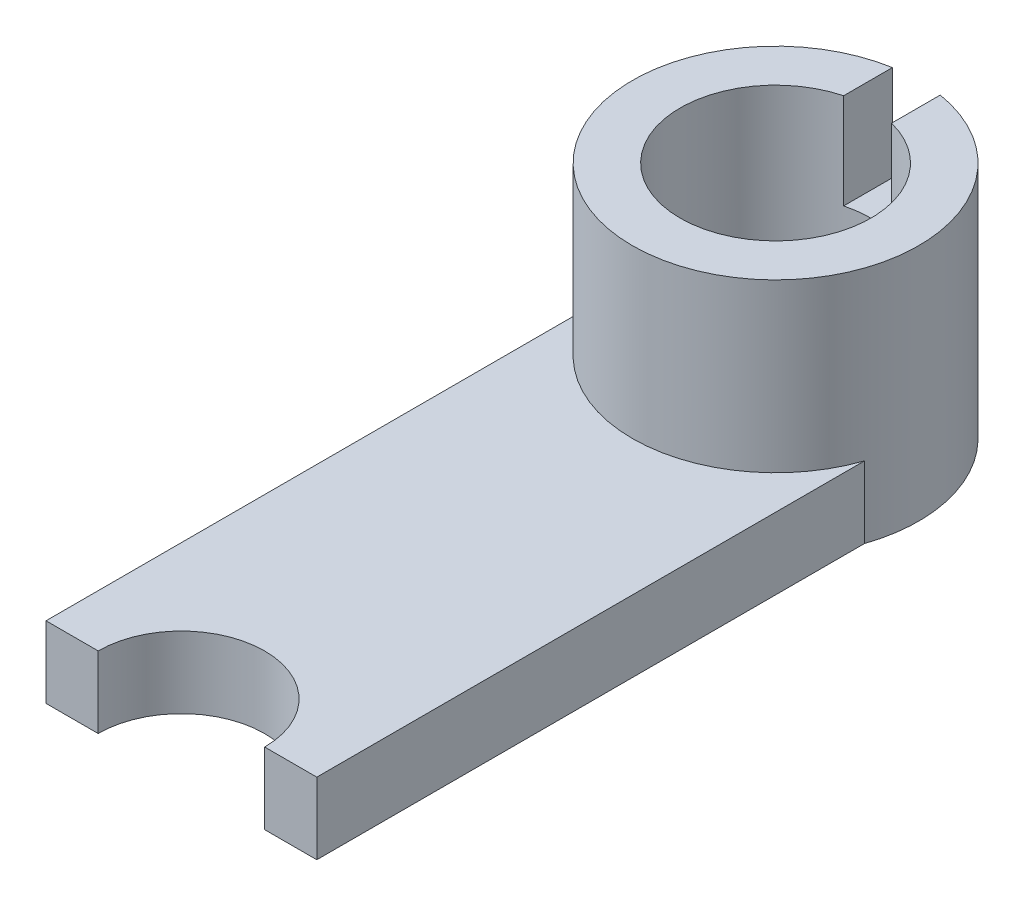
from build123d import *

# Parameters (mm, degrees)
SKETCH2_R               = 60000
SKETCH2_R_2             = 40000
BOSS_EXTRUDE1_DEPTH     = 100000
CUT_EXTRUDE1_DEPTH      = 14630
CUT_EXTRUDE1_DEPTH_BACK = 40000
SKETCH3_W               = 20000
SKETCH3_H               = 53751.270372234
SKETCH6_W               = 113487.639637956
SKETCH6_H               = 229519.025629528
BOSS_EXTRUDE3_DEPTH     = 30000
CUT_EXTRUDE2_DEPTH      = 28505
CUT_EXTRUDE2_DEPTH_BACK = 58994
SKETCH7_R               = 34880.887530656
CUT_EXTRUDE4_DEPTH      = 51190
CUT_EXTRUDE4_DEPTH_BACK = 76239
SKETCH8_R               = 40000


with BuildPart() as part:
    # Sketch2 → Boss-Extrude1 (new body)
    with BuildSketch(Plane(origin=(0, 0, 0), x_dir=(1, 0, 0), z_dir=(0, 1, 0))):
        with Locations(Location((0, 0, 0), (0, 0, 270))):
            Circle(SKETCH2_R)
        with Locations(Location((0, 0, 0), (0, 0, 270))):
            Circle(SKETCH2_R_2, mode=Mode.SUBTRACT)
    extrude(amount=BOSS_EXTRUDE1_DEPTH)

    # Sketch3 → Cut-Extrude1 (cut, two sides: drawn at the far end of the back side and taken through both)
    with BuildSketch(Plane(origin=(0, 100000, 0), x_dir=(1, 0, 0), z_dir=(0, 1, 0)).offset(-CUT_EXTRUDE1_DEPTH_BACK)):
        with Locations((-166.372945862, 35059.052743673)):
            Rectangle(SKETCH3_W, SKETCH3_H)
    extrude(amount=CUT_EXTRUDE1_DEPTH + CUT_EXTRUDE1_DEPTH_BACK, mode=Mode.SUBTRACT)

    # Sketch6 → Boss-Extrude3 (add)
    with BuildSketch(Plane.XZ):
        with Locations((0, 134256.664205451)):
            Rectangle(SKETCH6_W, SKETCH6_H)
    extrude(amount=-BOSS_EXTRUDE3_DEPTH)

    # Sketch7 → Cut-Extrude2 (cut, two sides: drawn at the far end of the back side and taken through both)
    with BuildSketch(Plane(origin=(0, 30000, 0), x_dir=(1, 0, 0), z_dir=(0, 1, 0)).offset(-CUT_EXTRUDE2_DEPTH_BACK)):
        with Locations((0, -249016.177020215)):
            Circle(SKETCH7_R)
    extrude(amount=CUT_EXTRUDE2_DEPTH + CUT_EXTRUDE2_DEPTH_BACK, mode=Mode.SUBTRACT)

    # Sketch8 → Cut-Extrude4 (cut, two sides: drawn at the far end of the back side and taken through both)
    with BuildSketch(Plane(origin=(0, 30000, 0), x_dir=(1, 0, 0), z_dir=(0, 1, 0)).offset(-CUT_EXTRUDE4_DEPTH_BACK)):
        with Locations(Location((0, 0, 0), (0, 0, 75.76847948))):
            Circle(SKETCH8_R)
    extrude(amount=CUT_EXTRUDE4_DEPTH + CUT_EXTRUDE4_DEPTH_BACK, mode=Mode.SUBTRACT)


solid = part.part
